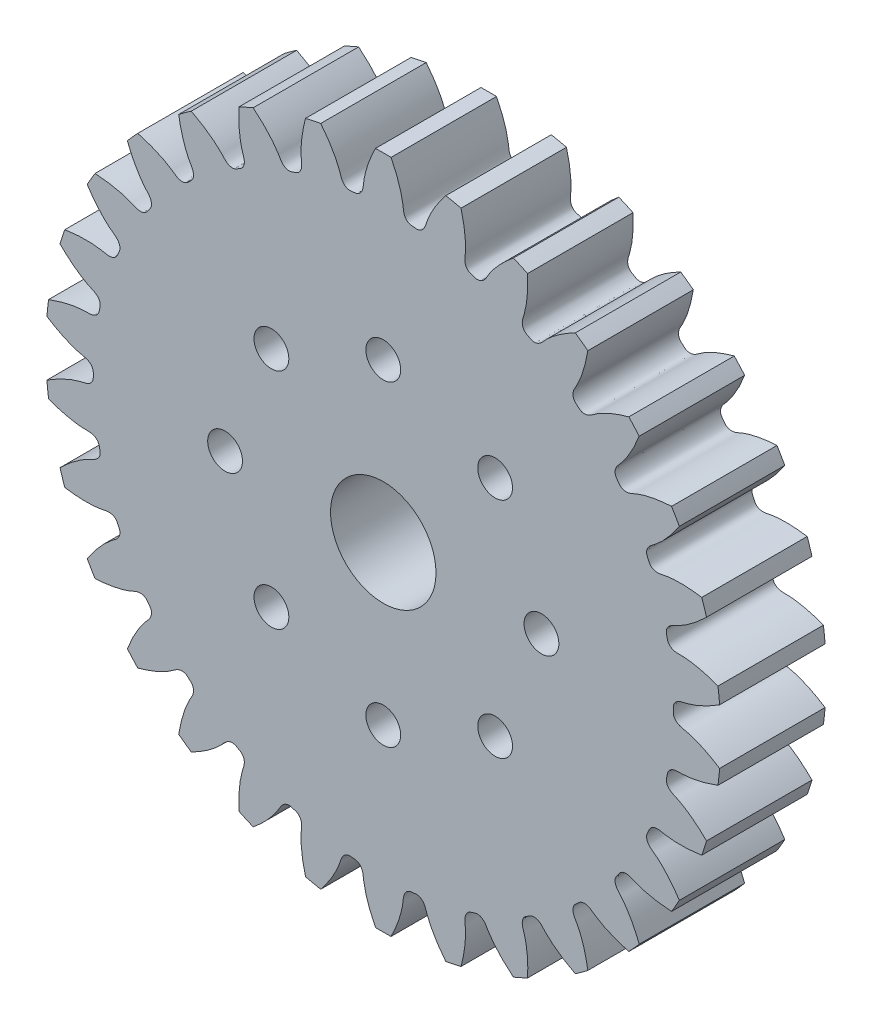
from build123d import *

# Parameters (mm, degrees)
SKETCHREVOLVESPURGEAR1_W       = 10
SKETCHREVOLVESPURGEAR1_H       = 32
TOOTHEXTRUDECUTSPURGEAR1_DEPTH = 5
PATTERNSPURGEAR1_COUNT         = 30
BOREREVOLVESKETCH_W            = 10
BOREREVOLVESKETCH_H            = 5
SKETCH_5_R                     = 1.65
CUT_EXTRUDE_2_DEPTH            = 10


with BuildPart() as part:
    # SketchRevolveSpurGear1 → SpurGear1 (revolve)
    with BuildSketch(Plane(origin=(0, 0, 0), x_dir=(0, 0, -1), z_dir=(1, 0, 0))):
        with Locations((0, 16)):
            Rectangle(SKETCHREVOLVESPURGEAR1_W, SKETCHREVOLVESPURGEAR1_H)
    revolve(axis=Axis((0, 0, 0), (0, 0, -1)))

    # SketchToothSpurGear1 → ToothExtrudeCutSpurGear1 (cut, symmetric)
    with BuildSketch(Plane.XY):
        with BuildLine():
            ThreePointArc((31.98852539, 2.672871743), (32.1, 0), (31.98852539, -2.672871743))
            add(Edge.make_bspline(
                [(31.98852539, -2.672871743), (31.66546641, -2.460357704), (31.23605042, -2.200207761), (30.697315312, -1.914820241), (30.406985947, -1.770997096), (30.131828722, -1.643888447), (29.872524975, -1.532555185), (29.629714452, -1.436035703), (29.40400029, -1.353336554), (29.19593017, -1.2834734), (29.006054223, -1.225343453), (28.834736489, -1.178141172), (28.555182847, -1.108088579), (28.290150415, -1.067625354), (28.056896922, -0.975629693), (27.9565536, -0.926863939), (27.857757182, -0.86659515), (27.759481054, -0.789833373), (27.662940136, -0.688893507), (27.574813545, -0.554989902), (27.516004178, -0.393797352), (27.492611179, -0.203387534), (27.504188249, 0), (27.492611179, 0.203387534), (27.516004178, 0.393797352), (27.574813545, 0.554989902), (27.662940136, 0.688893507), (27.759481054, 0.789833373), (27.857757182, 0.86659515), (27.9565536, 0.926863939), (28.056896922, 0.975629693), (28.290150415, 1.067625354), (28.555182847, 1.108088579), (28.834736489, 1.178141172), (29.006054223, 1.225343453), (29.19593017, 1.2834734), (29.40400029, 1.353336554), (29.629714452, 1.436035703), (29.872524975, 1.532555185), (30.131828722, 1.643888447), (30.406985947, 1.770997096), (30.697315312, 1.914820241), (31.23605042, 2.200207761), (31.66546641, 2.460357704), (31.98852539, 2.672871743)],
                knots=[0, 0, 0, 0, 0.105025693, 0.136251526, 0.165584885, 0.19302577, 0.218574179, 0.242230114, 0.263993574, 0.283864559, 0.30184307, 0.317929106, 0.332122667, 0.380161333, 0.390131607, 0.400121254, 0.410437088, 0.421509863, 0.433903709, 0.448219129, 0.464748151, 0.48001799, 0.5, 0.51998201, 0.535251849, 0.551780871, 0.566096291, 0.578490137, 0.589562912, 0.599878746, 0.609868393, 0.619838667, 0.667877333, 0.682070894, 0.69815693, 0.716135441, 0.736006426, 0.757769886, 0.781425821, 0.80697423, 0.834415115, 0.863748474, 0.894974307, 1, 1, 1, 1], degree=3))
        make_face()
    toothextrudecutspurgear1 = extrude(amount=TOOTHEXTRUDECUTSPURGEAR1_DEPTH, both=True, mode=Mode.SUBTRACT)

    # PatternSpurGear1: ToothExtrudeCutSpurGear1 ×30 about axis
    patternspurgear1_axis = Axis((0, 0, 55), (0, 0, -1))
    for i in range(1, PATTERNSPURGEAR1_COUNT):
        add(toothextrudecutspurgear1.rotate(patternspurgear1_axis, i * 360 / PATTERNSPURGEAR1_COUNT), mode=Mode.SUBTRACT)

    # BoreRevolveSketch → BoreRevolveCut (revolve, cut)
    with BuildSketch(Plane(origin=(0, 0, 0), x_dir=(0, 0, -1), z_dir=(1, 0, 0))):
        with Locations((0, 2.5)):
            Rectangle(BOREREVOLVESKETCH_W, BOREREVOLVESKETCH_H)
    revolve(axis=Axis((0, 0, 0), (0, 0, -1)), mode=Mode.SUBTRACT)

    # 草图5 → 切除-拉伸2 (cut)
    with BuildSketch(Plane.XY.offset(5)):
        with Locations((0, 15)):
            Circle(SKETCH_5_R)
        with Locations((10.606601718, 10.606601718)):
            Circle(SKETCH_5_R)
        with Locations((15, 0)):
            Circle(SKETCH_5_R)
        with Locations((10.606601718, -10.606601718)):
            Circle(SKETCH_5_R)
        with Locations((0, -15)):
            Circle(SKETCH_5_R)
        with Locations((-10.606601718, -10.606601718)):
            Circle(SKETCH_5_R)
        with Locations((-15, 0)):
            Circle(SKETCH_5_R)
        with Locations((-10.606601718, 10.606601718)):
            Circle(SKETCH_5_R)
    extrude(amount=-CUT_EXTRUDE_2_DEPTH, mode=Mode.SUBTRACT)


solid = part.part
